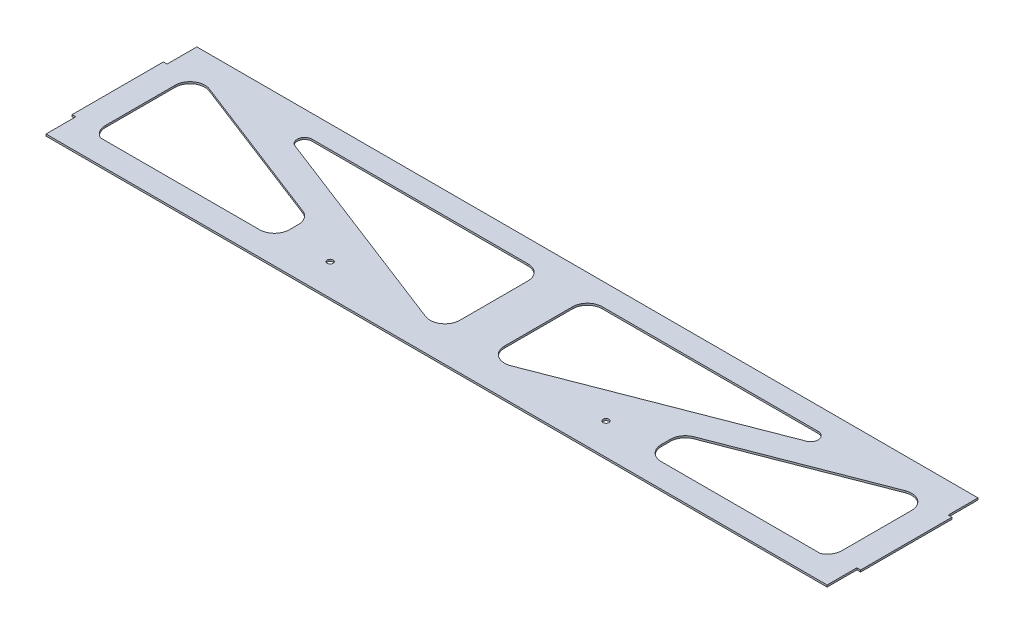
from build123d import *

# Parameters (mm, degrees)
BOSS_EXTRUDE1_DEPTH = 1.5875
CUT_EXTRUDE2_DEPTH  = 343.657797193
SKETCH4_R           = 2.5
CUT_EXTRUDE3_DEPTH  = 343.657797193


with BuildPart() as part:
    # Sketch1 → Boss-Extrude1 (new body)
    with BuildSketch(Plane(origin=(0, 0, 0), x_dir=(1, 0, 0), z_dir=(0, 1, 0))):
        Polygon((-333.375, 38.989), (-333.375, 64.389), (333.375, 64.389), (333.375, 38.989), (336.55, 38.989), (336.55, -38.989), (333.375, -38.989), (333.375, -64.389), (-333.375, -64.389), (-333.375, -38.989), (-336.55, -38.989), (-336.55, 38.989), align=None)
    extrude(amount=BOSS_EXTRUDE1_DEPTH)

    # Sketch3 → Cut-Extrude2 (cut, through all)
    with BuildSketch(Plane(origin=(0, 1.5875, 0), x_dir=(1, 0, 0), z_dir=(0, 1, 0))):
        with BuildLine():
            Line((-314.325, 26.808799864), (-314.325, -32.639))
            ThreePointArc((-314.325, -32.639), (-312.428265266, -39.315785124), (-307.304612663, -43.998225326))
            Line((-307.304612663, -43.998225326), (-171.45, -43.998225326))
            ThreePointArc((-171.45, -43.998225326), (-162.469743879, -40.278481447), (-158.75, -31.298225326))
            Line((-158.75, -31.298225326), (-158.75, -23.549607936))
            ThreePointArc((-158.75, -23.549607936), (-160.974250295, -16.369867821), (-166.867900491, -11.705015748))
            Line((-166.867900491, -11.705015748), (-297.042900491, 38.653392051))
            ThreePointArc((-297.042900491, 38.653392051), (-308.804740115, 37.284549569), (-314.325, 26.808799864))
        make_face()
        with BuildLine():
            Line((-215.969521054, 45.339), (-31.75, 45.339))
            ThreePointArc((-31.75, 45.339), (-22.769743879, 41.619256121), (-19.05, 32.639))
            Line((-19.05, 32.639), (-19.05, -25.46802519))
            ThreePointArc((-19.05, -25.46802519), (-24.570259885, -35.943774895), (-36.332099509, -37.312617377))
            Line((-36.332099509, -37.312617377), (-218.260570808, 33.066703906))
            ThreePointArc((-218.260570808, 33.066703906), (-222.211679342, 40.154315366), (-215.969521054, 45.339))
        make_face()
        with BuildLine():
            Line((36.332099509, -37.312617377), (218.260570808, 33.066703906))
            ThreePointArc((218.260570808, 33.066703906), (222.211679342, 40.154315366), (215.969521054, 45.339))
            Line((215.969521054, 45.339), (31.75, 45.339))
            ThreePointArc((31.75, 45.339), (22.769743879, 41.619256121), (19.05, 32.639))
            Line((19.05, 32.639), (19.05, -25.46802519))
            ThreePointArc((19.05, -25.46802519), (24.570259885, -35.943774895), (36.332099509, -37.312617377))
        make_face()
        with BuildLine():
            Line((314.325, 26.808799864), (314.325, -32.639))
            ThreePointArc((314.325, -32.639), (312.428265266, -39.315785124), (307.304612663, -43.998225326))
            Line((307.304612663, -43.998225326), (171.45, -43.998225326))
            ThreePointArc((171.45, -43.998225326), (162.469743879, -40.278481447), (158.75, -31.298225326))
            Line((158.75, -31.298225326), (158.75, -23.549607936))
            ThreePointArc((158.75, -23.549607936), (160.974250295, -16.369867821), (166.867900491, -11.705015748))
            Line((166.867900491, -11.705015748), (297.042900491, 38.653392051))
            ThreePointArc((297.042900491, 38.653392051), (308.804740115, 37.284549569), (314.325, 26.808799864))
        make_face()
    extrude(amount=-CUT_EXTRUDE2_DEPTH, mode=Mode.SUBTRACT)

    # Sketch4 → Cut-Extrude3 (cut, through all)
    with BuildSketch(Plane(origin=(0, 1.5875, 0), x_dir=(1, 0, 0), z_dir=(0, 1, 0))):
        with Locations(Location((-117.729, -37.465, 0), (0, 0, 270))):
            Circle(SKETCH4_R)
        with Locations(Location((117.729, -37.465, 0), (0, 0, 90))):
            Circle(SKETCH4_R)
    extrude(amount=-CUT_EXTRUDE3_DEPTH, mode=Mode.SUBTRACT)


solid = part.part
